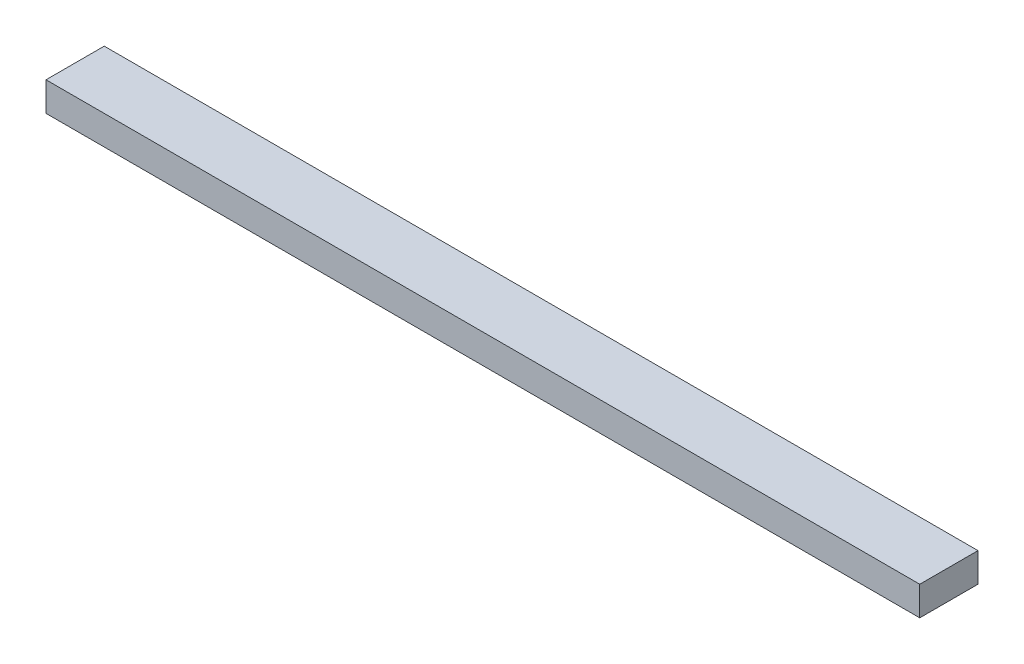
from build123d import *

# Parameters (mm, degrees)
SKETCH1_W           = 30
SKETCH1_H           = 2
BOSS_EXTRUDE1_DEPTH = 1


with BuildPart() as part:
    # Sketch1 → Boss-Extrude1 (new body)
    with BuildSketch(Plane(origin=(0, 0, 0), x_dir=(1, 0, 0), z_dir=(0, 1, 0))):
        Rectangle(SKETCH1_W, SKETCH1_H)
    extrude(amount=BOSS_EXTRUDE1_DEPTH)


solid = part.part
